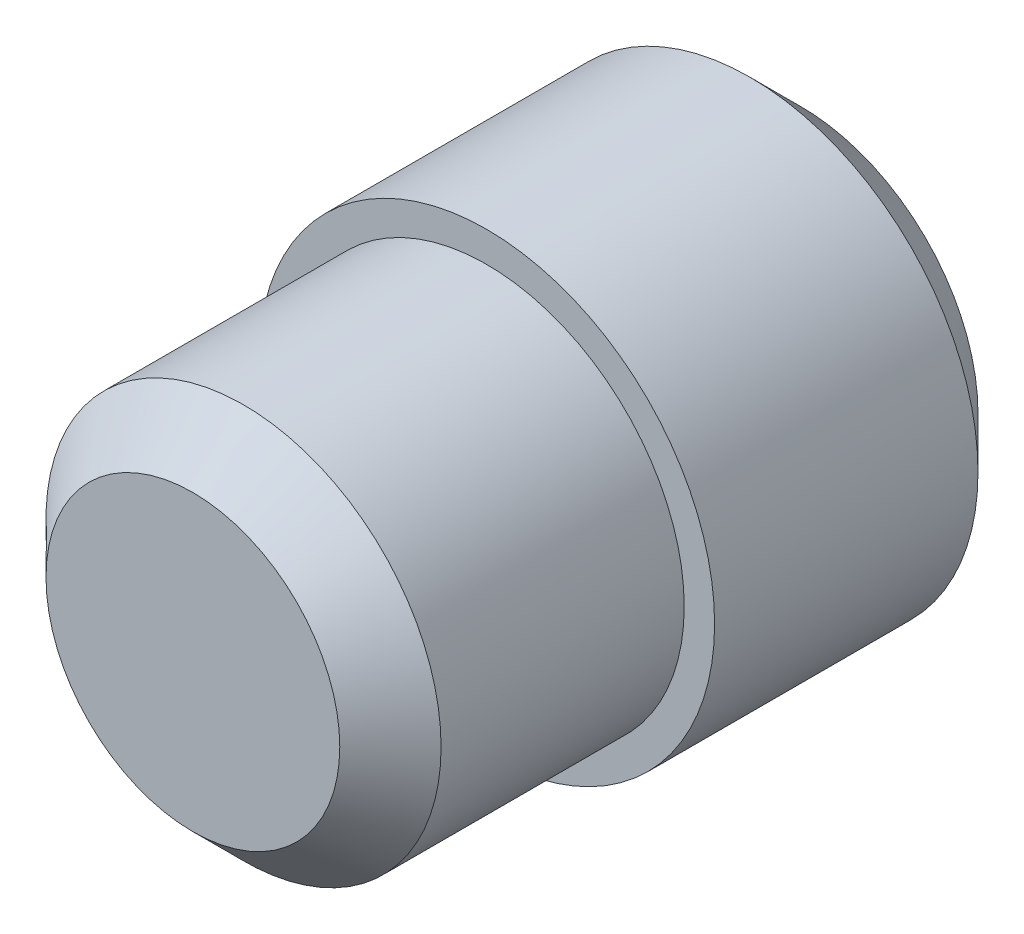
from build123d import *

# Parameters (mm, degrees)
SKETCH_1_R      = 2.25
EXTRUDE_1_DEPTH = 3.1
SKETCH_2_R      = 1.95
EXTRUDE_2_DEPTH = 2.9
CHAMFER_1_SIZE  = 0.5


with BuildPart() as part:
    # 草图1 → 拉伸1 (new body)
    with BuildSketch(Plane.XY):
        with Locations(Location((0, 0, 0), (0, 0, 180))):
            Circle(SKETCH_1_R)
    extrude(amount=EXTRUDE_1_DEPTH)

    # 草图2 → 拉伸2 (add)
    with BuildSketch(Plane.XY.offset(3.1)):
        Circle(SKETCH_2_R)
    extrude(amount=EXTRUDE_2_DEPTH)

    # 倒角1
    chamfer_1_edges = [part.edges().sort_by_distance(p)[0] for p in [
        (2.25, 0, 0),
        (-1.95, 0, 6),
    ]]
    chamfer(chamfer_1_edges, length=CHAMFER_1_SIZE)


solid = part.part
